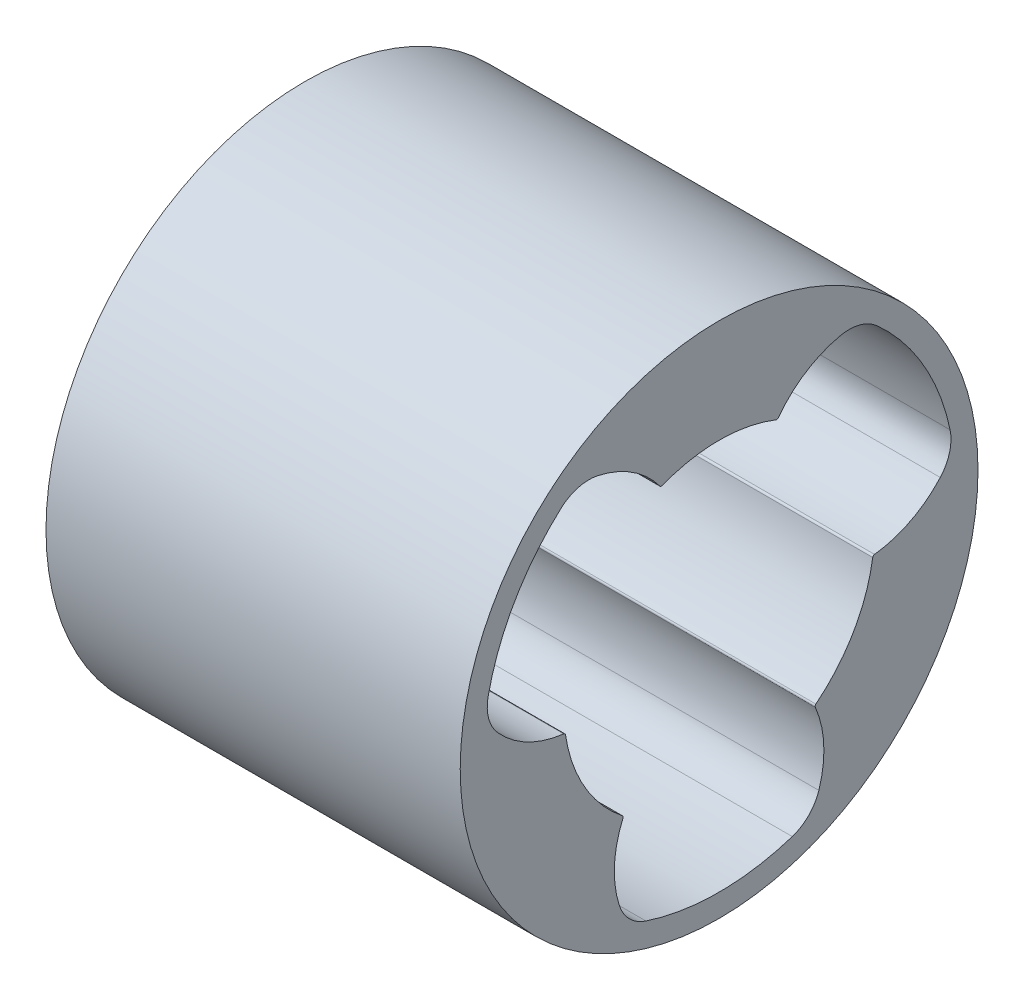
from build123d import *

# Parameters (mm, degrees)
SKETCH1_W             = 50.8
SKETCH1_H             = 31.75
CUT_EXTRUDE1_DEPTH    = 43.18
CUT_EXTRUDE2_DEPTH    = 43.18
CUT_EXTRUDE3_DEPTH    = 43.18
M36_CLEARANCE_HOLE1_D = 38.1
FILLET1_R             = 5.08
FILLET2_R             = 0.254


with BuildPart() as part:
    # Sketch1 → Revolve1 (revolve)
    with BuildSketch(Plane(origin=(0, 0, 0), x_dir=(-1, 0, 0), z_dir=(0, 0, -1)), mode=Mode.PRIVATE) as revolve1_sk:
        with Locations((-25.4, 15.875)):
            Rectangle(SKETCH1_W, SKETCH1_H)
    revolve(revolve1_sk.sketch.rotate(Axis((50.8, 0, 0), (-1, 0, 0)), 270), axis=Axis((50.8, 0, 0), (-1, 0, 0)))

    # Sketch2 → Cut-Extrude1 (cut)
    with BuildSketch(Plane(origin=(50.8, 0, 0), x_dir=(0, 0, -1), z_dir=(1, 0, 0))):
        with BuildLine():
            ThreePointArc((-17.574990767, 23.012380049), (-25.076631592, 14.478), (-28.716801108, 3.714198451))
            ThreePointArc((-28.716801108, 3.714198451), (-6.467131306, 3.7338), (-17.574990767, 23.012380049))
        make_face()
    extrude(amount=-CUT_EXTRUDE1_DEPTH, mode=Mode.SUBTRACT)

    # Sketch3 → Cut-Extrude2 (cut)
    with BuildSketch(Plane(origin=(50.8, 0, 0), x_dir=(0, 0, -1), z_dir=(1, 0, 0))):
        with BuildLine():
            ThreePointArc((-11.141810341, -26.7265785), (0, -28.956), (11.141810341, -26.7265785))
            ThreePointArc((11.141810341, -26.7265785), (0, -7.4676), (-11.141810341, -26.7265785))
        make_face()
    extrude(amount=-CUT_EXTRUDE2_DEPTH, mode=Mode.SUBTRACT)

    # Sketch4 → Cut-Extrude3 (cut)
    with BuildSketch(Plane(origin=(50.8, 0, 0), x_dir=(0, 0, -1), z_dir=(1, 0, 0))):
        with BuildLine():
            ThreePointArc((28.716801108, 3.714198451), (25.076631592, 14.478), (17.574990767, 23.01238005))
            ThreePointArc((17.574990767, 23.01238005), (6.467131305, 3.7338), (28.716801108, 3.714198451))
        make_face()
    extrude(amount=-CUT_EXTRUDE3_DEPTH, mode=Mode.SUBTRACT)

    # M36 Clearance Hole1 (through all)
    with Locations(Plane.ZY):
        with Locations((0, 0)):
            Hole(M36_CLEARANCE_HOLE1_D / 2)

    # Fillet1
    fillet1_edges = [part.edges().sort_by_distance(p)[0] for p in [
        (29.21, 23.012380049, 17.574990767),
        (29.21, 3.714198451, 28.716801108),
        (29.21, -26.7265785, 11.141810341),
        (29.21, -26.7265785, -11.141810341),
        (29.21, 3.714198451, -28.716801108),
        (29.21, 23.01238005, -17.574990767),
    ]]
    fillet(fillet1_edges, radius=FILLET1_R)

    # Fillet2
    fillet2_edges = [part.edges().sort_by_distance(p)[0] for p in [
        (29.21, 17.654613605, -7.156613617),
        (29.21, -2.629497604, -18.867650684),
        (29.21, 17.654613605, 7.156613618),
        (29.21, -15.025116, -11.711037067),
        (29.21, -15.025116, 11.711037067),
        (29.21, -2.629497604, 18.867650684),
    ]]
    fillet(fillet2_edges, radius=FILLET2_R)


solid = part.part
